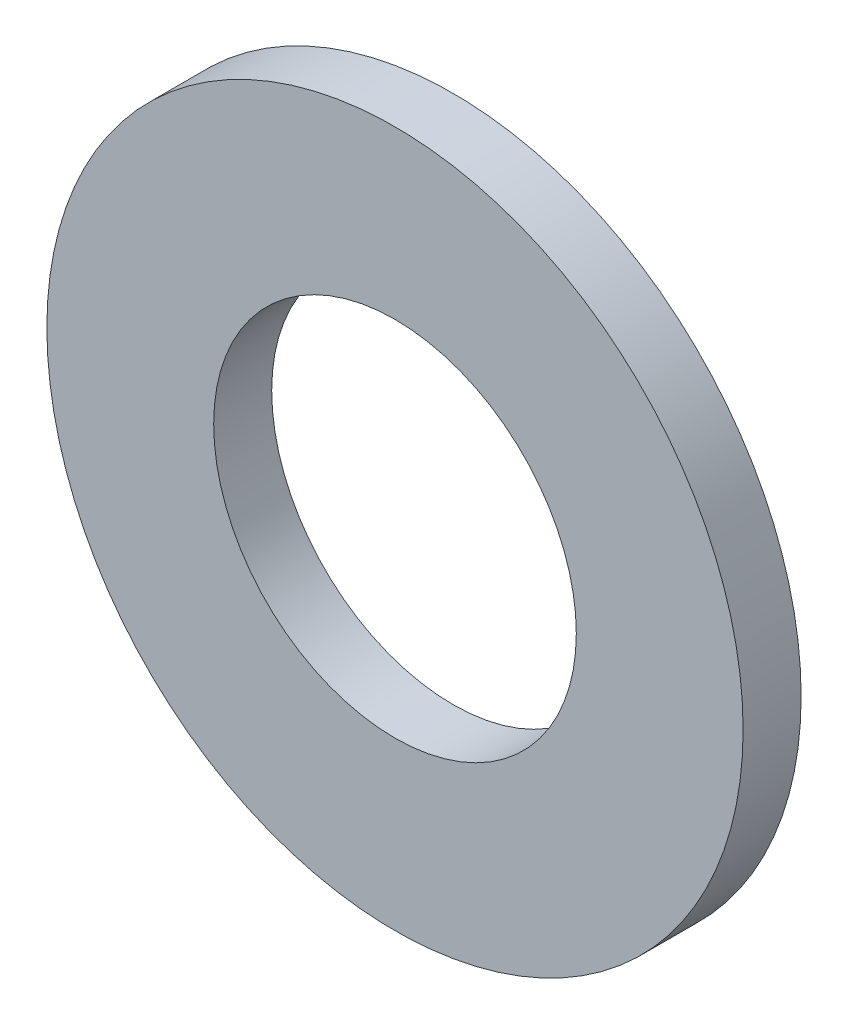
from build123d import *

# Parameters (mm, degrees)
IZIM1_R                     = 6
IZIM1_R_2                   = 3.125
Y_KSEKLIK_EKSTR_ZYON1_DEPTH = 1


with BuildPart() as part:
    # Çizim1 → Yükseklik-Ekstrüzyon1 (new body)
    with BuildSketch(Plane.XY):
        Circle(IZIM1_R)
        Circle(IZIM1_R_2, mode=Mode.SUBTRACT)
    extrude(amount=Y_KSEKLIK_EKSTR_ZYON1_DEPTH)


solid = part.part
